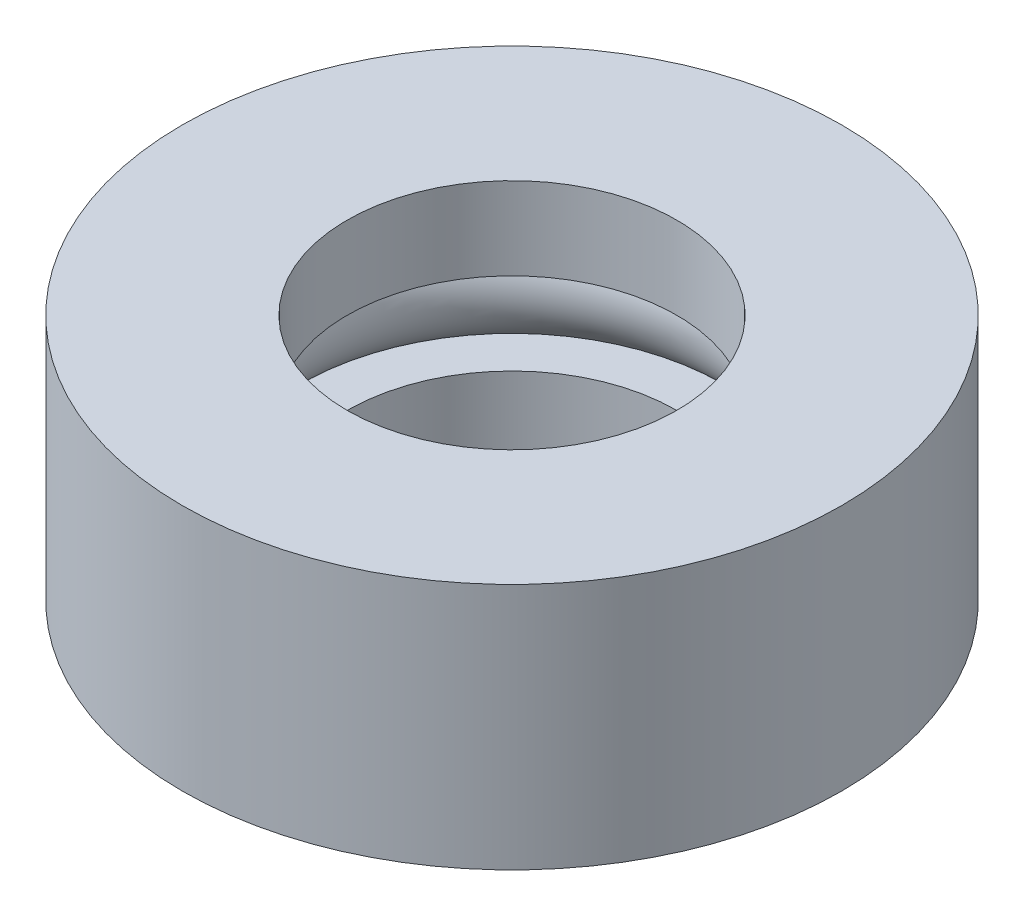
from build123d import *

# Parameters (mm, degrees)
SKETCH_3_R      = 1
SKETCH_5_R      = 6
SKETCH_5_R_2    = 3
EXTRUDE_1_DEPTH = 1.5
SKETCH_6_R      = 6
SKETCH_6_R_2    = 5.25
EXTRUDE_3_DEPTH = 1.5
EXTRUDE_START   = 1.5
SKETCH_7_R      = 6
SKETCH_7_R_2    = 3
EXTRUDE_4_DEPTH = 1.5


with BuildPart() as part:
    # ｽｹｯﾁ3 → 回転3 (revolve)
    with BuildSketch(Plane(origin=(0, 0, 0), x_dir=(0, 0, -1), z_dir=(1, 0, 0))):
        with Locations((-4.5, 0)):
            Circle(SKETCH_3_R)
    revolve(axis=Axis((0, 7.993421053, 0), (0, -1, 0)))



with BuildPart() as body_2:
    # ｽｹｯﾁ5 → ﾎﾞｽ - 押し出し1 (new body)
    with BuildSketch(Plane(origin=(0, 0.75, 0), x_dir=(1, 0, 0), z_dir=(0, 1, 0))):
        with Locations(Location((0, 0, 0), (0, 0, 270))):
            Circle(SKETCH_5_R)
        with Locations(Location((0, 0, 0), (0, 0, 270))):
            Circle(SKETCH_5_R_2, mode=Mode.SUBTRACT)
    extrude(amount=EXTRUDE_1_DEPTH)


with BuildPart() as part_1:
    add(part.part)

    add(body_2.part)  # ﾎﾞｽ - 押し出し3 merges body 2
    # ｽｹｯﾁ6 → ﾎﾞｽ - 押し出し3 (add)
    with BuildSketch(Plane.XZ.offset(-0.75)):
        with Locations(Location((0, 0, 0), (0, 0, 90))):
            Circle(SKETCH_6_R)
        with Locations(Location((0, 0, 0), (0, 0, 90))):
            Circle(SKETCH_6_R_2, mode=Mode.SUBTRACT)
    extrude(amount=EXTRUDE_3_DEPTH)

    # ｽｹｯﾁ7 → ﾎﾞｽ - 押し出し4 (add)
    with BuildSketch(Plane.XZ.offset(0.75).offset(EXTRUDE_START)):
        with Locations(Location((0, 0, 0), (0, 0, 90))):
            Circle(SKETCH_7_R)
        with Locations(Location((0, 0, 0), (0, 0, 90))):
            Circle(SKETCH_7_R_2, mode=Mode.SUBTRACT)
    extrude(amount=-EXTRUDE_4_DEPTH)


solid = part_1.part
